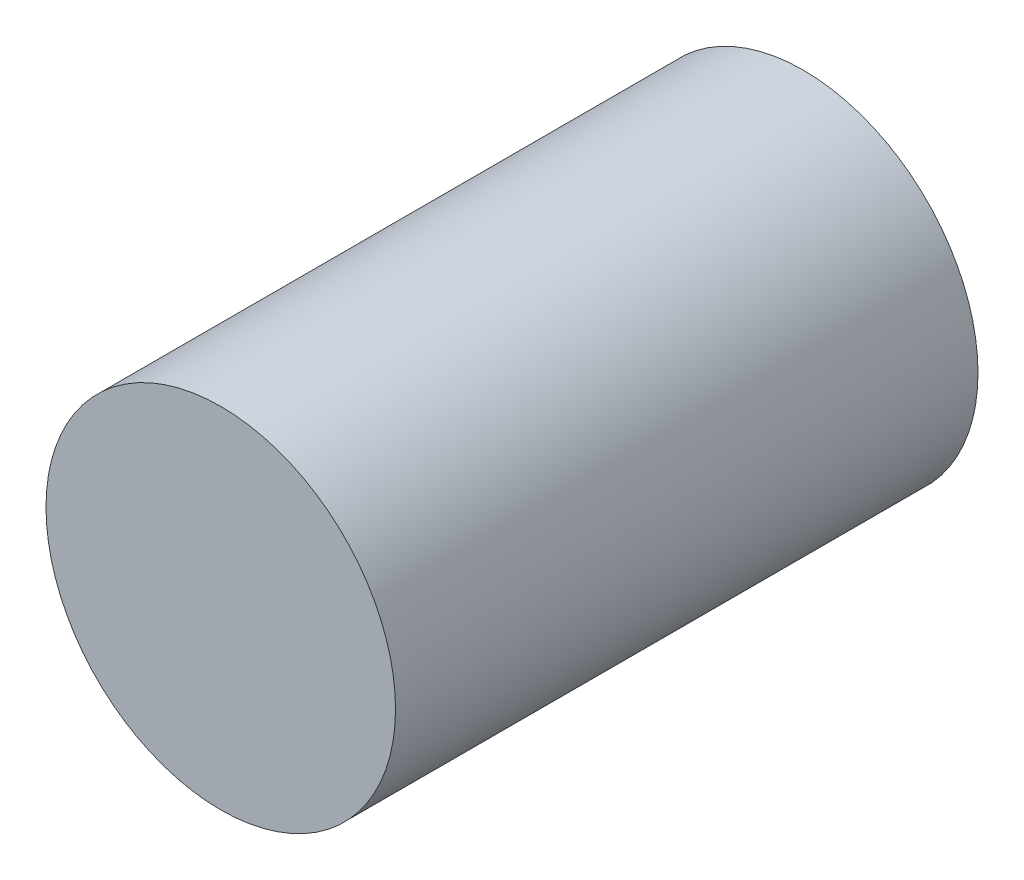
from build123d import *

# Parameters (mm, degrees)
SKETCH_3_R      = 0.03
EXTRUDE_2_DEPTH = 0.1


with BuildPart() as part:
    # 草图3 → 凸台-拉伸2 (new body)
    with BuildSketch(Plane.XY):
        Circle(SKETCH_3_R)
    extrude(amount=EXTRUDE_2_DEPTH)


solid = part.part
